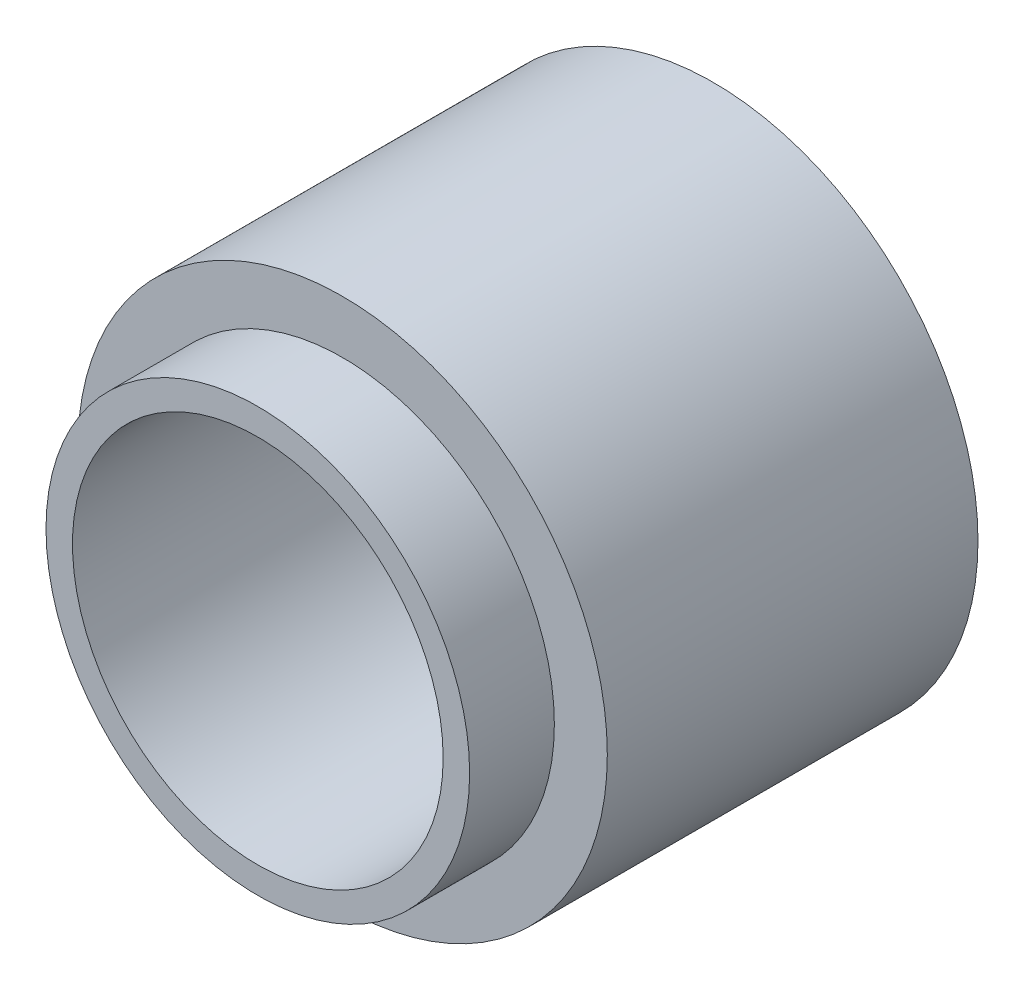
from build123d import *

# Parameters (mm, degrees)
SKETCH1_R           = 5
BOSS_EXTRUDE1_DEPTH = 7
SKETCH2_R           = 3.5
CUT_EXTRUDE1_DEPTH  = 10.949874371
BOSS_EXTRUDE4_START = 1.6
SKETCH3_R           = 4
SKETCH3_R_2         = 3.5
BOSS_EXTRUDE4_DEPTH = 1.6


with BuildPart() as part:
    # Sketch1 → Boss-Extrude1 (new body)
    with BuildSketch(Plane.XY):
        Circle(SKETCH1_R)
    extrude(amount=BOSS_EXTRUDE1_DEPTH)

    # Sketch2 → Cut-Extrude1 (cut, through all)
    with BuildSketch(Plane.XY.offset(7)):
        Circle(SKETCH2_R)
    extrude(amount=-CUT_EXTRUDE1_DEPTH, mode=Mode.SUBTRACT)

    # Sketch3 → Boss-Extrude4 (add)
    with BuildSketch(Plane.XY.offset(7).offset(BOSS_EXTRUDE4_START)):
        Circle(SKETCH3_R)
        Circle(SKETCH3_R_2, mode=Mode.SUBTRACT)
    extrude(amount=-BOSS_EXTRUDE4_DEPTH)


solid = part.part
